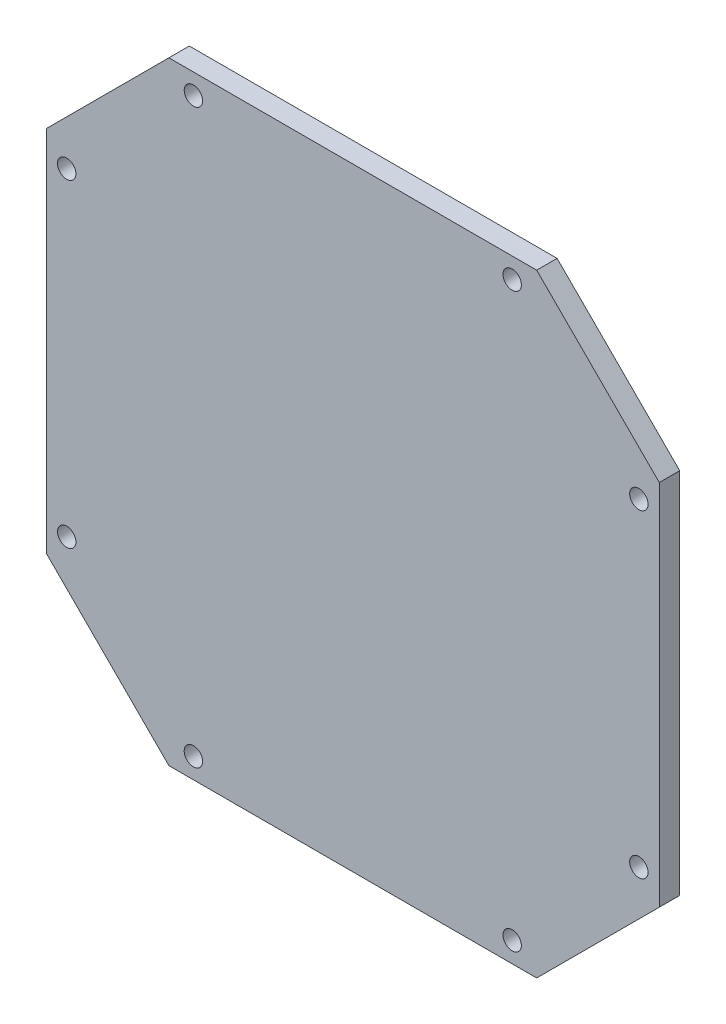
from build123d import *

# Parameters (mm, degrees)
BOSS_EXTRUDE1_DEPTH   = 10
F_1_0MM_DOWEL_HOLE1_D = 9


with BuildPart() as part:
    # Sketch1 → Boss-Extrude1 (new body)
    with BuildSketch(Plane.XY):
        Polygon((60, 0), (0, 60), (0, 240), (60, 300), (240, 300), (300, 240), (300, 60), (240, 0), align=None)
    extrude(amount=BOSS_EXTRUDE1_DEPTH)

    # Ø1.0mm Dowel Hole1 (through all)
    with Locations(Plane.XY.offset(10)):
        with Locations((10, 228), (290, 228), (228, 290), (72, 290)):
            f_1_0mm_dowel_hole1 = Hole(F_1_0MM_DOWEL_HOLE1_D / 2)

    # Mirror1: Ø1.0mm Dowel Hole1 across plane
    add(f_1_0mm_dowel_hole1.mirror(Plane(origin=(0, 150, 0), x_dir=(0, 0, 1), z_dir=(0, -1, 0))), mode=Mode.SUBTRACT)


solid = part.part
